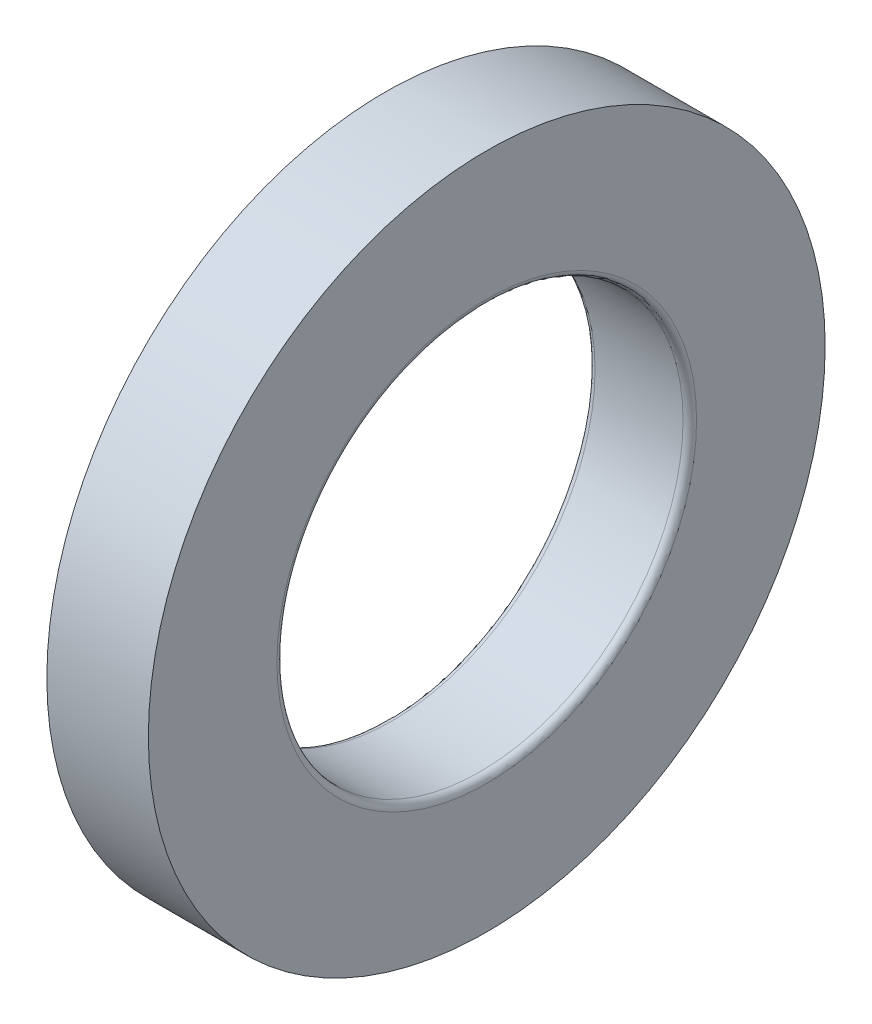
from build123d import *

# Parameters (mm, degrees)
ESBO_O2_R                = 50
RESSALTO_EXTRUS_O1_DEPTH = 15
ESBO_O3_R                = 30
CORTE_EXTRUS_O1_DEPTH    = 73.284161474
FILETE1_R                = 1


with BuildPart() as part:
    # Esboço2 → Ressalto-extrusão1 (new body)
    with BuildSketch(Plane(origin=(0, 0, 0), x_dir=(0, 0, -1), z_dir=(1, 0, 0))):
        Circle(ESBO_O2_R)
    extrude(amount=RESSALTO_EXTRUS_O1_DEPTH)

    # Esboço3 → Corte-extrusão1 (cut, through all)
    with BuildSketch(Plane(origin=(15, 0, 0), x_dir=(0, 0, -1), z_dir=(1, 0, 0))):
        Circle(ESBO_O3_R)
    extrude(amount=-CORTE_EXTRUS_O1_DEPTH, mode=Mode.SUBTRACT)

    # Filete1
    filete1_edges = [part.edges().sort_by_distance(p)[0] for p in [
        (0, 0, 30),
        (15, 0, 30),
    ]]
    fillet(filete1_edges, radius=FILETE1_R)


solid = part.part
